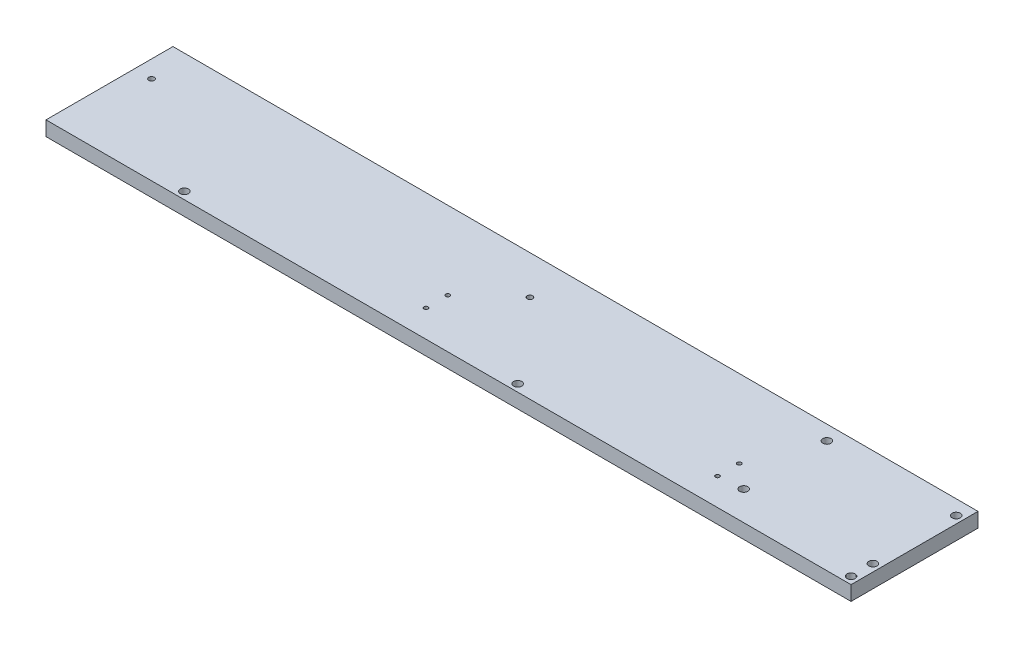
from build123d import *

# Parameters (mm, degrees)
SKETCH1_W           = 350.99
SKETCH1_H           = 55.35
SKETCH1_R           = 1.7859375
SKETCH1_R_2         = 0.889
SKETCH1_R_3         = 1.190625
BOSS_EXTRUDE1_DEPTH = 6.35


with BuildPart() as part:
    # Sketch1 → Boss-Extrude1 (new body)
    with BuildSketch(Plane(origin=(0, 0, 0), x_dir=(1, 0, 0), z_dir=(0, 1, 0))):
        with Locations((-175.495, 27.675)):
            Rectangle(SKETCH1_W, SKETCH1_H)
        with Locations(Location((-293.84, 3.175, 0), (0, 0, 270))):
            Circle(SKETCH1_R, mode=Mode.SUBTRACT)
        with Locations(Location((-197.16, 11.85, 0), (0, 0, 270))):
            Circle(SKETCH1_R_2, mode=Mode.SUBTRACT)
        with Locations(Location((-197.16, 21.35, 0), (0, 0, 270))):
            Circle(SKETCH1_R_2, mode=Mode.SUBTRACT)
        with Locations(Location((-70.1, 21.35, 0), (0, 0, 270))):
            Circle(SKETCH1_R_2, mode=Mode.SUBTRACT)
        with Locations(Location((-70.1, 11.85, 0), (0, 0, 270))):
            Circle(SKETCH1_R_2, mode=Mode.SUBTRACT)
        with Locations(Location((-343.49, 38.5, 0), (0, 0, 270))):
            Circle(SKETCH1_R_3, mode=Mode.SUBTRACT)
        with Locations(Location((-178.49, 38.5, 0), (0, 0, 270))):
            Circle(SKETCH1_R_3, mode=Mode.SUBTRACT)
        with Locations(Location((-3.175, 3.175, 0), (0, 0, 270))):
            Circle(SKETCH1_R, mode=Mode.SUBTRACT)
        with Locations(Location((-3.175, 49, 0), (0, 0, 270))):
            Circle(SKETCH1_R, mode=Mode.SUBTRACT)
        with Locations(Location((-3.175, 12.7, 0), (0, 0, 270))):
            Circle(SKETCH1_R, mode=Mode.SUBTRACT)
        with Locations(Location((-148.5075, 3.175, 0), (0, 0, 270))):
            Circle(SKETCH1_R, mode=Mode.SUBTRACT)
        with Locations(Location((-59.525, 49, 0), (0, 0, 270))):
            Circle(SKETCH1_R, mode=Mode.SUBTRACT)
        with Locations(Location((-59.525, 12.7, 0), (0, 0, 270))):
            Circle(SKETCH1_R, mode=Mode.SUBTRACT)
    extrude(amount=BOSS_EXTRUDE1_DEPTH)


solid = part.part
